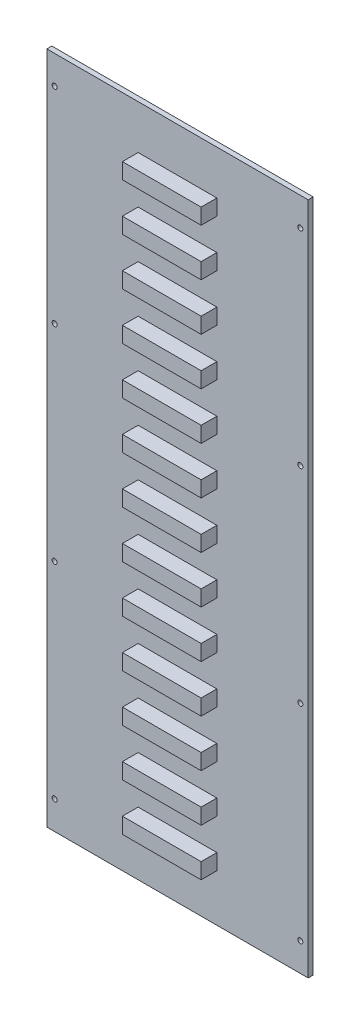
from build123d import *

# Parameters (mm, degrees)
SKETCH1_W                 = 83
SKETCH1_H                 = 214
BOSS_EXTRUDE1_DEPTH       = 1.5875
SKETCH2_W                 = 25
SKETCH2_H                 = 5
BOSS_EXTRUDE2_DEPTH       = 5
F_0_CLEARANCE_HOLE1_D     = 1.6129
F_0_CLEARANCE_HOLE1_DEPTH = 3.175
F_0_CLEARANCE_HOLE1_TIP   = 0.484564046
SKETCH6_W                 = 72.5
SKETCH6_H                 = 7
BOSS_EXTRUDE3_DEPTH       = 4.9125


with BuildPart() as part:
    # Sketch1 → Boss-Extrude1 (new body)
    with BuildSketch(Plane.XY):
        Rectangle(SKETCH1_W, SKETCH1_H)
    extrude(amount=BOSS_EXTRUDE1_DEPTH)

    # Sketch2 → Boss-Extrude2 (add)
    with BuildSketch(Plane.XY.offset(1.5875)):
        with Locations((0, 90.5)):
            Rectangle(SKETCH2_W, SKETCH2_H)
        with Locations((0, 75.5)):
            Rectangle(SKETCH2_W, SKETCH2_H)
        with Locations((0, 60.5)):
            Rectangle(SKETCH2_W, SKETCH2_H)
        with Locations((0, 45.5)):
            Rectangle(SKETCH2_W, SKETCH2_H)
        with Locations((0, 30.5)):
            Rectangle(SKETCH2_W, SKETCH2_H)
        with Locations((0, 15.5)):
            Rectangle(SKETCH2_W, SKETCH2_H)
        with Locations((0, 0.5)):
            Rectangle(SKETCH2_W, SKETCH2_H)
        with Locations((0, -14.5)):
            Rectangle(SKETCH2_W, SKETCH2_H)
        with Locations((0, -29.5)):
            Rectangle(SKETCH2_W, SKETCH2_H)
        with Locations((0, -44.5)):
            Rectangle(SKETCH2_W, SKETCH2_H)
        with Locations((0, -59.5)):
            Rectangle(SKETCH2_W, SKETCH2_H)
        with Locations((0, -74.5)):
            Rectangle(SKETCH2_W, SKETCH2_H)
        with Locations((0, -89.5)):
            Rectangle(SKETCH2_W, SKETCH2_H)
    extrude(amount=BOSS_EXTRUDE2_DEPTH)

    # #0 Clearance Hole1
    with Locations(Plane.XY.offset(1.5875)):
        with Locations((-39, 98), (39, 98), (-39, 32.666666667), (39, 32.666666667), (-39, -32.666666667), (39, -32.666666667), (-39, -98), (39, -98)):
            Hole(F_0_CLEARANCE_HOLE1_D / 2, depth=F_0_CLEARANCE_HOLE1_DEPTH)
            with Locations((0, 0, -(F_0_CLEARANCE_HOLE1_DEPTH + F_0_CLEARANCE_HOLE1_TIP / 2))):  # 118° drill point
                Cone(0, F_0_CLEARANCE_HOLE1_D / 2, F_0_CLEARANCE_HOLE1_TIP, mode=Mode.SUBTRACT)

    # Sketch6 → Boss-Extrude3 (add)
    with BuildSketch(Plane(origin=(0, 0, 0), x_dir=(-1, 0, 0), z_dir=(0, 0, -1))):
        with Locations((0.05, -3.5)):
            Rectangle(SKETCH6_W, SKETCH6_H)
    extrude(amount=BOSS_EXTRUDE3_DEPTH)


solid = part.part
